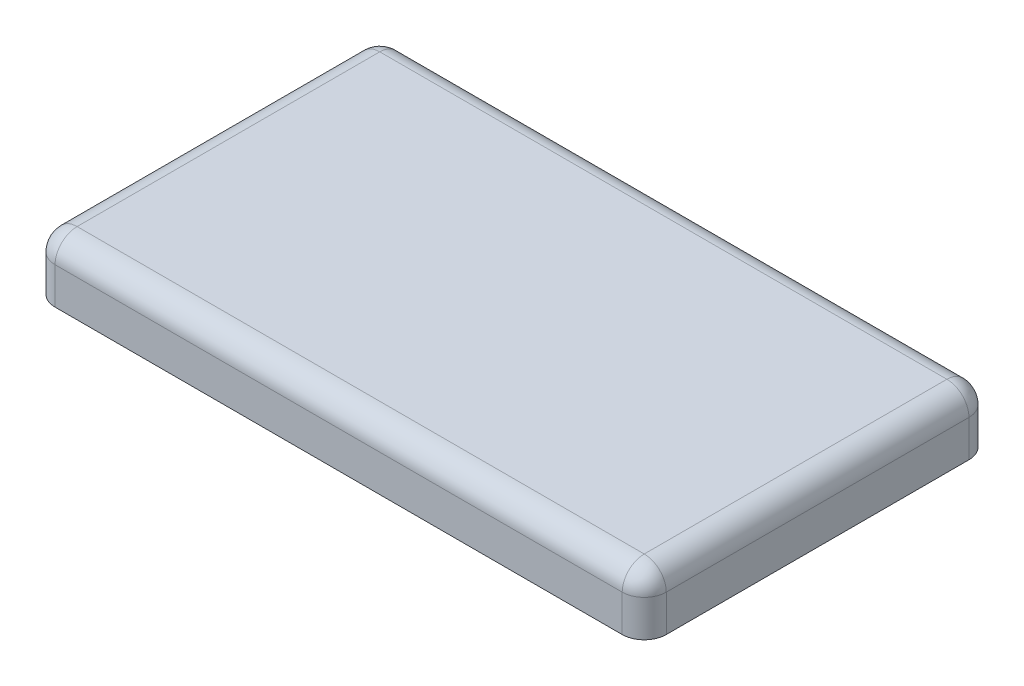
from build123d import *

# Parameters (mm, degrees)
SKETCH1_W           = 41.6
SKETCH1_H           = 23.6
BOSS_EXTRUDE1_DEPTH = 4
SKETCH2_W           = 39
SKETCH2_H           = 21
CUT_EXTRUDE1_DEPTH  = 2.6
FILLET1_R           = 1.5


with BuildPart() as part:
    # Sketch1 → Boss-Extrude1 (new body)
    with BuildSketch(Plane(origin=(0, 0, 0), x_dir=(1, 0, 0), z_dir=(0, 1, 0))):
        with Locations((20.8, 11.8)):
            Rectangle(SKETCH1_W, SKETCH1_H)
    extrude(amount=BOSS_EXTRUDE1_DEPTH)

    # Sketch2 → Cut-Extrude1 (cut)
    with BuildSketch(Plane.XZ):
        with Locations((20.8, -11.8)):
            Rectangle(SKETCH2_W, SKETCH2_H)
    extrude(amount=-CUT_EXTRUDE1_DEPTH, mode=Mode.SUBTRACT)

    # Fillet1
    fillet1_edges = [part.edges().sort_by_distance(p)[0] for p in [
        (41.6, 4, -11.8),
        (20.8, 4, -23.6),
        (0, 4, -11.8),
        (20.8, 4, 0),
        (0, 2, -23.6),
        (41.6, 2, -23.6),
        (41.6, 2, 0),
        (0, 2, 0),
    ]]
    fillet(fillet1_edges, radius=FILLET1_R)


solid = part.part
